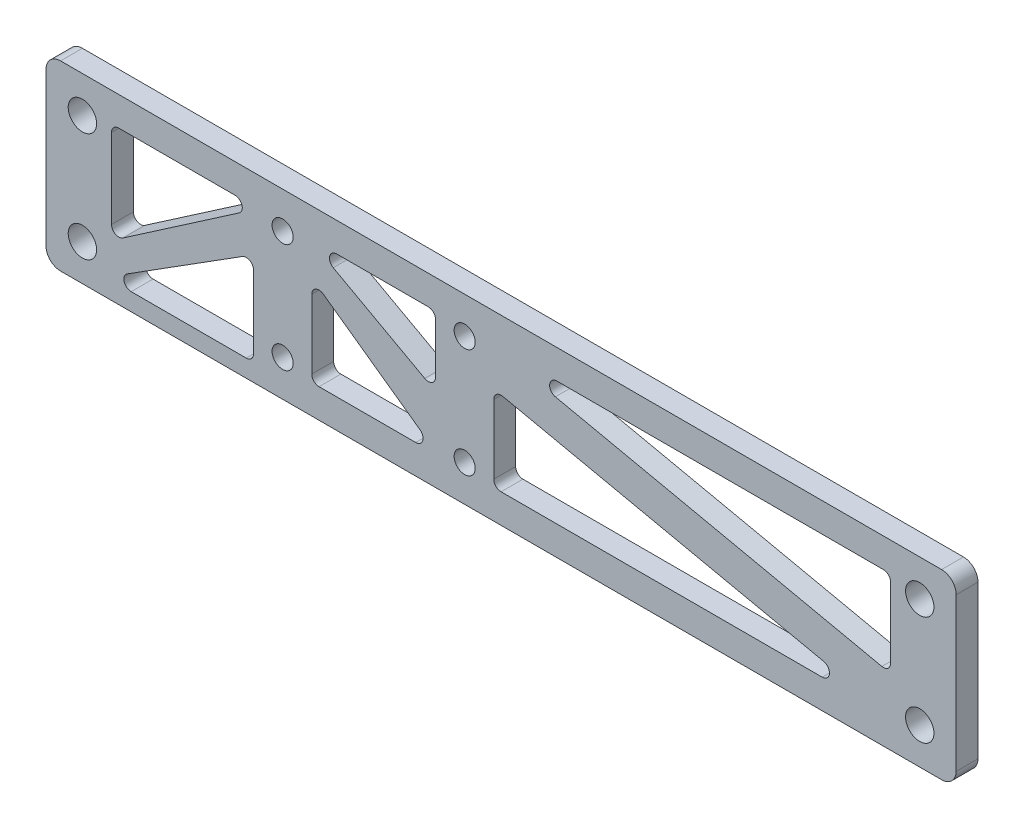
from build123d import *

# Parameters (mm, degrees)
SKETCH_1_W          = 125
SKETCH_1_H          = 25
SKETCH_1_R          = 1.45
SKETCH_1_R_2        = 1.95
EXTRUDE_1_DEPTH     = 3
CUT_EXTRUDE_1_DEPTH = 10
FILLET_1_R          = 2
FILLET_2_R          = 1


with BuildPart() as part:
    # 草图1 → 凸台-拉伸1 (new body)
    with BuildSketch(Plane.XY):
        with Locations((62.5, 12.5)):
            Rectangle(SKETCH_1_W, SKETCH_1_H)
        with Locations((32.5, 20)):
            Circle(SKETCH_1_R, mode=Mode.SUBTRACT)
        with Locations((57.5, 20)):
            Circle(SKETCH_1_R, mode=Mode.SUBTRACT)
        with Locations((57.5, 5)):
            Circle(SKETCH_1_R, mode=Mode.SUBTRACT)
        with Locations((32.5, 5)):
            Circle(SKETCH_1_R, mode=Mode.SUBTRACT)
        with Locations((5, 20)):
            Circle(SKETCH_1_R_2, mode=Mode.SUBTRACT)
        with Locations((5, 5)):
            Circle(SKETCH_1_R_2, mode=Mode.SUBTRACT)
        with Locations((120, 20)):
            Circle(SKETCH_1_R_2, mode=Mode.SUBTRACT)
        with Locations((120, 5)):
            Circle(SKETCH_1_R_2, mode=Mode.SUBTRACT)
    extrude(amount=EXTRUDE_1_DEPTH)

    # 草图2 → 切除-拉伸1 (cut)
    with BuildSketch(Plane.XY.offset(3)):
        Polygon((60.767753727, 21), (116, 21), (116, 9.114458974), align=None)
        Polygon((61.5, 15.727967439), (61.5, 4), (116, 4), align=None)
        Polygon((36.02221675, 21), (53.5, 21), (53.5, 11.425425105), align=None)
        Polygon((36.5, 16.432325355), (36.5, 4), (53.904028142, 4), align=None)
        Polygon((29.180055305, 21), (9, 21), (9, 7.144539038), align=None)
        Polygon((28.5, 15.183615903), (28.5, 2.402022244), (8.239478793, 2.402022244), align=None)
    extrude(amount=-CUT_EXTRUDE_1_DEPTH, mode=Mode.SUBTRACT)

    # 圆角1
    fillet_1_edges = [part.edges().sort_by_distance(p)[0] for p in [
        (0, 25, 1.5),
        (125, 25, 1.5),
        (125, 0, 1.5),
        (0, 0, 1.5),
    ]]
    fillet(fillet_1_edges, radius=FILLET_1_R)

    # 圆角2
    fillet_2_edges = [part.edges().sort_by_distance(p)[0] for p in [
        (116, 9.114458974, 1.5),
        (60.767753727, 21, 1.5),
        (116, 21, 1.5),
        (29.180055305, 21, 1.5),
        (9, 7.144539038, 1.5),
        (9, 21, 1.5),
        (36.5, 16.432325355, 1.5),
        (53.904028142, 4, 1.5),
        (36.5, 4, 1.5),
        (53.5, 11.425425105, 1.5),
        (36.02221675, 21, 1.5),
        (53.5, 21, 1.5),
        (61.5, 15.727967439, 1.5),
        (116, 4, 1.5),
        (61.5, 4, 1.5),
        (8.239478793, 2.402022244, 1.5),
        (28.5, 15.183615903, 1.5),
        (28.5, 2.402022244, 1.5),
    ]]
    fillet(fillet_2_edges, radius=FILLET_2_R)


solid = part.part
